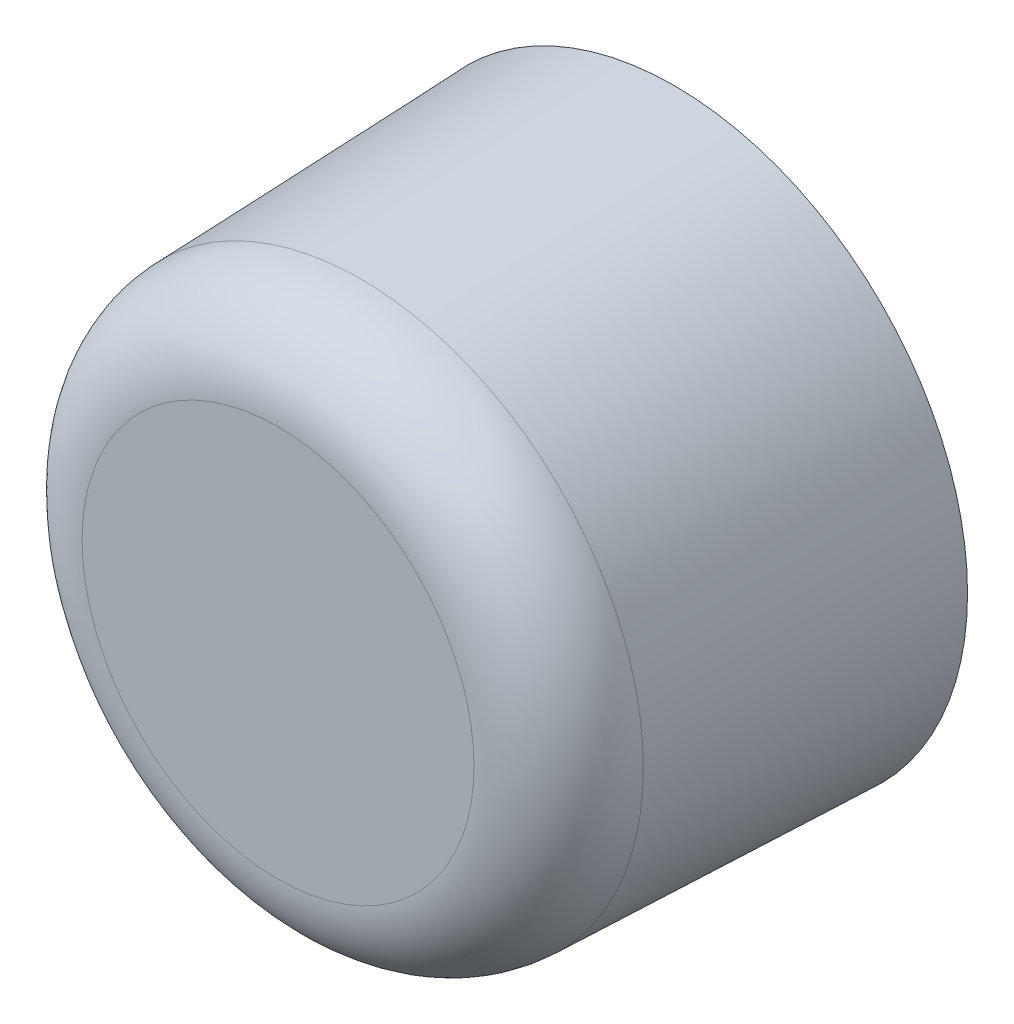
from build123d import *

# Parameters (mm, degrees)
SKETCH_1_R      = 3.4
EXTRUDE_1_DEPTH = 4.6
EXTRUDE_1_TAPER = 2
FILLET_1_R      = 1


with BuildPart() as part:
    # 草图1 → 凸台-拉伸1 (new body)
    with BuildSketch(Plane.XY):
        Circle(SKETCH_1_R)
    extrude(amount=EXTRUDE_1_DEPTH, taper=EXTRUDE_1_TAPER)

    # 圆角1
    fillet_1_edges = [part.edges().sort_by_distance(p)[0] for p in [
        (-3.23936446, 0, 4.6),
    ]]
    fillet(fillet_1_edges, radius=FILLET_1_R)


solid = part.part
